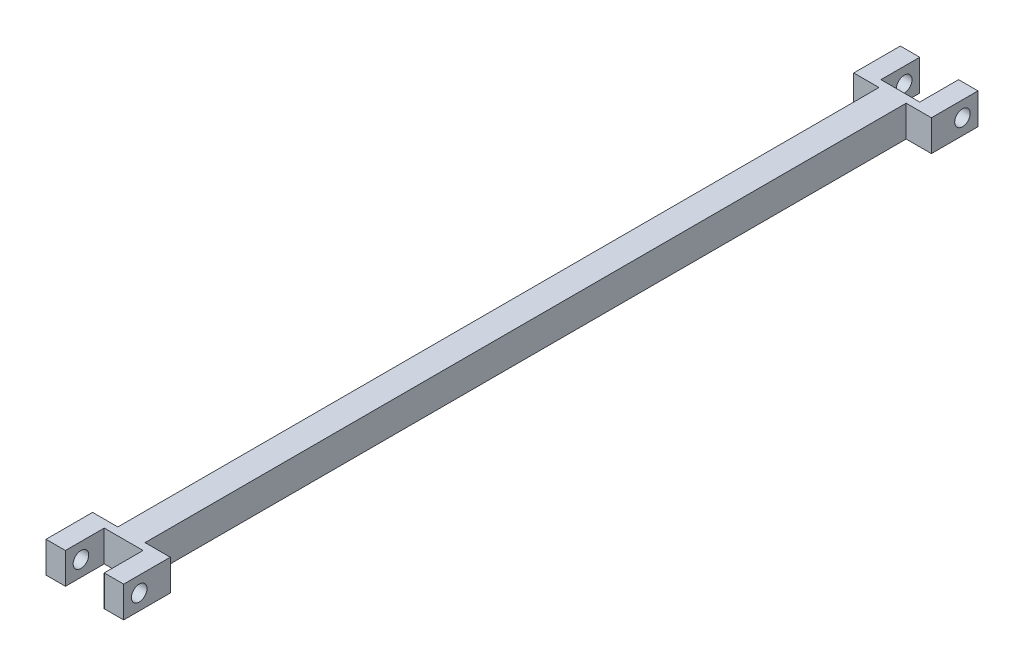
from build123d import *

# Parameters (mm, degrees)
SZKIC1_W                    = 35
SZKIC1_H                    = 40
DODANIE_WYCI_GNI_CIE1_DEPTH = 980
SZKIC2_W                    = 100
SZKIC2_H                    = 40
DODANIE_WYCI_GNI_CIE2_DEPTH = 10
SZKIC3_W                    = 25
SZKIC3_H                    = 40
DODANIE_WYCI_GNI_CIE3_DEPTH = 50
SZKIC4_R                    = 10
WYTNIJ_WYCI_GNI_CIE3_DEPTH  = 1060.811303959


with BuildPart() as part:
    # Szkic1 → Dodanie-wyciągnięcie1 (new body)
    with BuildSketch(Plane.XY):
        with Locations((17.5, 20)):
            Rectangle(SZKIC1_W, SZKIC1_H)
    extrude(amount=DODANIE_WYCI_GNI_CIE1_DEPTH)

    # Szkic2 → Dodanie-wyciągnięcie2 (add)
    with BuildSketch(Plane.XY.offset(980)):
        with Locations((17.5, 20)):
            Rectangle(SZKIC2_W, SZKIC2_H)
    dodanie_wyci_gni_cie2 = extrude(amount=DODANIE_WYCI_GNI_CIE2_DEPTH)

    # Szkic3 → Dodanie-wyciągnięcie3 (add)
    with BuildSketch(Plane.XY.offset(990)):
        with Locations((-20, 20)):
            Rectangle(SZKIC3_W, SZKIC3_H)
        with Locations((55, 20)):
            Rectangle(SZKIC3_W, SZKIC3_H)
    dodanie_wyci_gni_cie3 = extrude(amount=DODANIE_WYCI_GNI_CIE3_DEPTH)

    # Szkic4 → Wytnij-wyciągnięcie3 (cut, through all)
    with BuildSketch(Plane(origin=(167.5, 0, 0), x_dir=(0, 0, -1), z_dir=(1, 0, 0))):
        with Locations((-1020, 20)):
            Circle(SZKIC4_R)
    wytnij_wyci_gni_cie3 = extrude(amount=-WYTNIJ_WYCI_GNI_CIE3_DEPTH, mode=Mode.SUBTRACT)

    # Lustro1: Dodanie-wyciągnięcie2, Dodanie-wyciągnięcie3, Wytnij-wyciągnięcie3 across plane
    add(dodanie_wyci_gni_cie2.mirror(Plane(origin=(0, 0, 490), x_dir=(1, 0, 0), z_dir=(0, 0, -1))))
    add(dodanie_wyci_gni_cie3.mirror(Plane(origin=(0, 0, 490), x_dir=(1, 0, 0), z_dir=(0, 0, -1))))
    add(wytnij_wyci_gni_cie3.mirror(Plane(origin=(0, 0, 490), x_dir=(1, 0, 0), z_dir=(0, 0, -1))), mode=Mode.SUBTRACT)


solid = part.part
